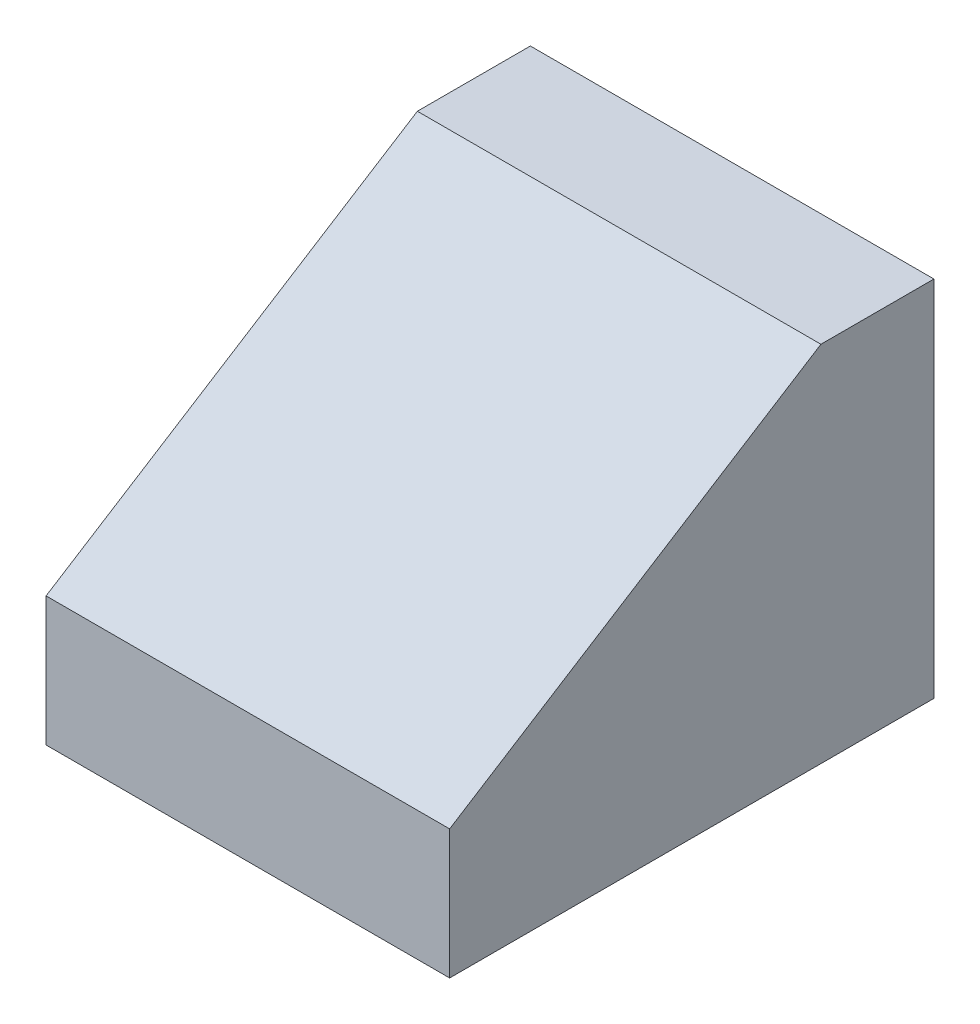
from build123d import *

# Parameters (mm, degrees)
BOSS_EXTRU_1_DEPTH = 50


with BuildPart() as part:
    # Esquisse1 → Boss.-Extru.1 (new, symmetric)
    with BuildSketch(Plane(origin=(0, 0, 0), x_dir=(0, 0, -1), z_dir=(1, 0, 0))):
        Polygon((-49.253731343, 0), (70.746268657, 0), (70.746268657, 90), (42.746268657, 90), (-49.253731343, 32), align=None)
    extrude(amount=BOSS_EXTRU_1_DEPTH, both=True)


solid = part.part
